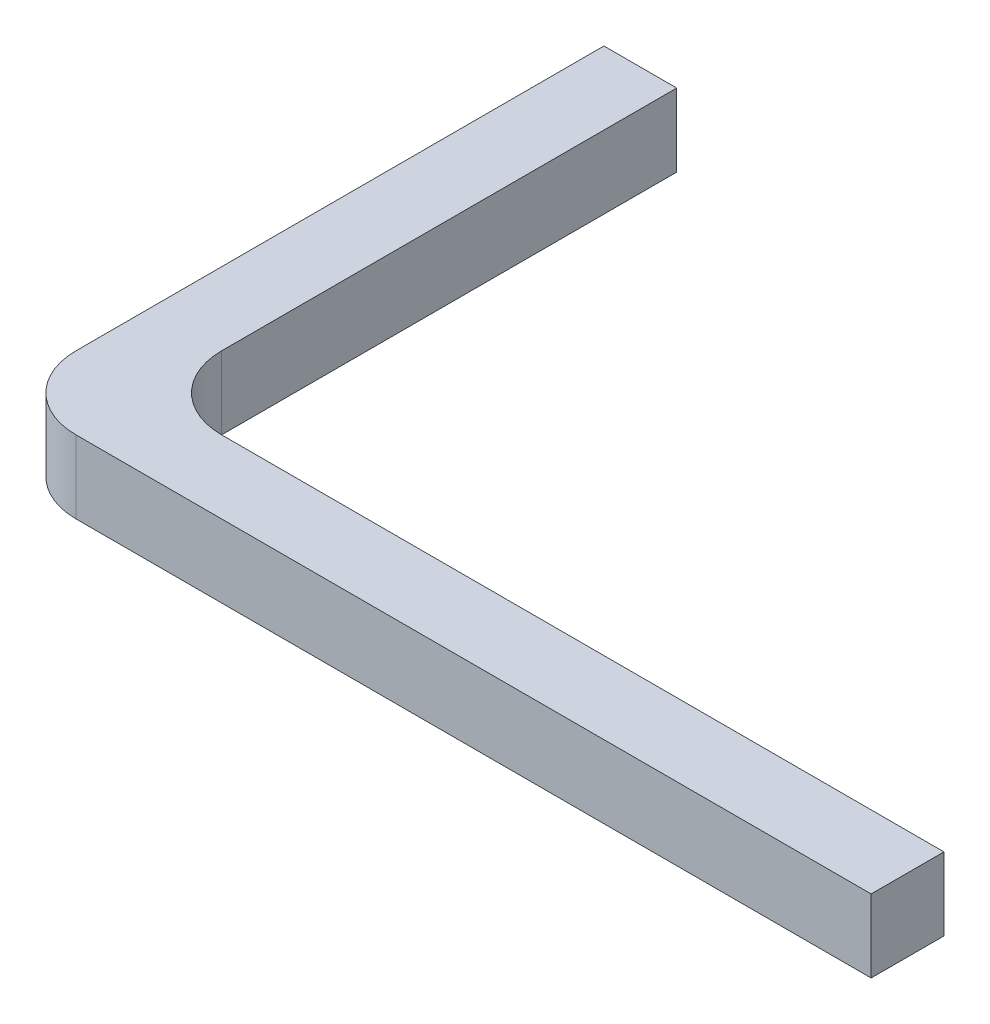
from build123d import *

# Parameters (mm, degrees)
BOSS_EXTRUDE1_DEPTH = 20
FILLET1_R           = 20


with BuildPart() as part:
    # Sketch1 → Boss-Extrude1 (new body)
    with BuildSketch(Plane(origin=(0, 0, 0), x_dir=(1, 0, 0), z_dir=(0, 1, 0))):
        Polygon((-218.4, 10), (0, 10), (0, -10), (-238.4, -10), (-238.4, 155), (-218.4, 155), align=None)
    extrude(amount=BOSS_EXTRUDE1_DEPTH)

    # Fillet1
    fillet1_edges = [part.edges().sort_by_distance(p)[0] for p in [
        (-238.4, 10, 10),
        (-218.4, 10, -10),
    ]]
    fillet(fillet1_edges, radius=FILLET1_R)


solid = part.part
